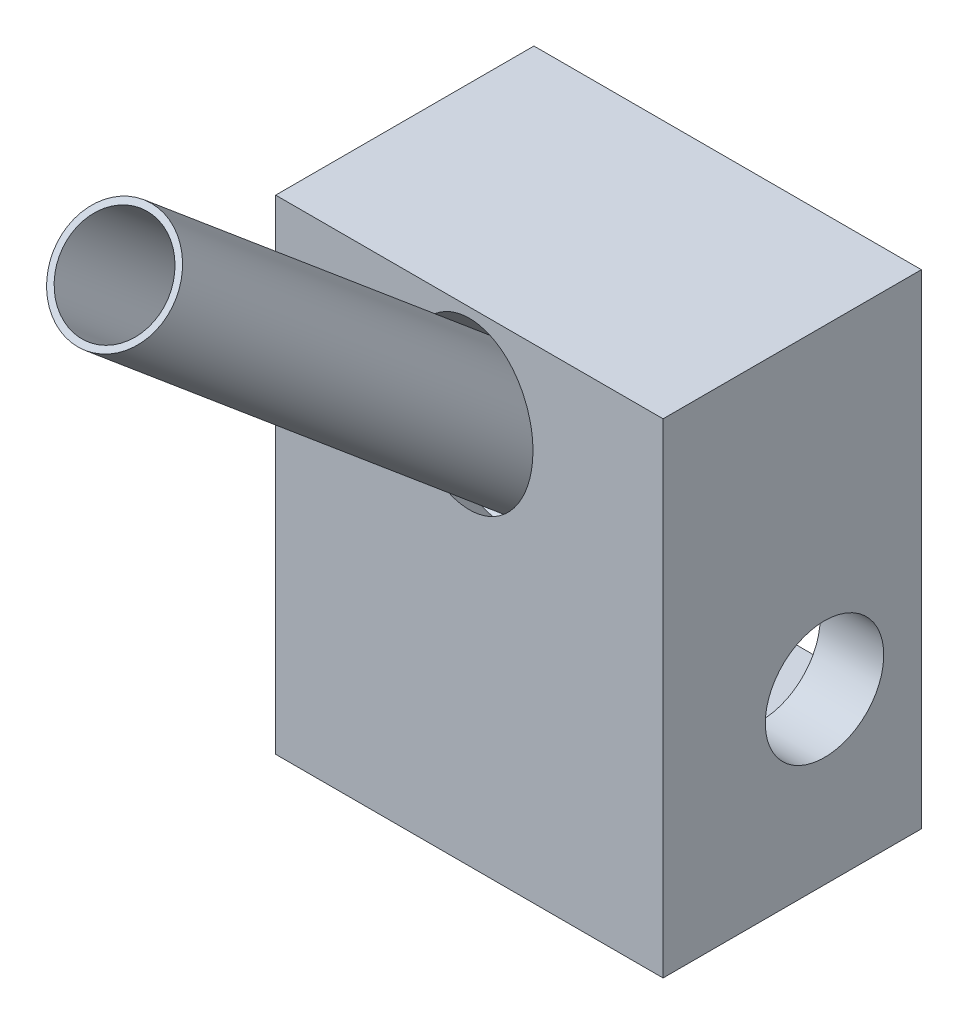
from build123d import *

# Parameters (mm, degrees)
BOSS_EXTRUDE1_START                            = 7.5
SKETCH1_W                                      = 30.48
SKETCH1_H                                      = 38.1
BOSS_EXTRUDE1_DEPTH                            = 20.32
SKETCH2_W                                      = 20.4
SKETCH2_H                                      = 22.86
CUT_EXTRUDE1_DEPTH                             = 17.78
SKETCH5_R                                      = 5
CUT_EXTRUDE2_DEPTH                             = 23
BOSS_EXTRUDE2_DEPTH                            = 21.59
BOSS_EXTRUDE2_DEPTH_BACK                       = 31.75
SKETCH10_R                                     = 4.5
SKETCH11_R                                     = 4
CUT_EXTRUDE6_DEPTH                             = 7540.718926849
CSK_FOR_M3_FLAT_HEAD_MACHINE_SCREW1_AT_2_COUNT = 2
CSK_FOR_M3_FLAT_HEAD_MACHINE_SCREW1_AT_2_PITCH = 36.262943744
CSK_FOR_M3_FLAT_HEAD_MACHINE_SCREW1_AT_3_COUNT = 2
CSK_FOR_M3_FLAT_HEAD_MACHINE_SCREW1_AT_3_PITCH = 30.250374024
SKETCH17_R                                     = 4.659600795
CUT_EXTRUDE7_DEPTH                             = 5742.70602656


with BuildPart() as part:
    # Sketch1 → Boss-Extrude1 (new body)
    with BuildSketch(Plane.XY.offset(BOSS_EXTRUDE1_START)):
        with Locations((6081.534193548, -5722.275806452)):
            Rectangle(SKETCH1_W, SKETCH1_H)
    extrude(amount=BOSS_EXTRUDE1_DEPTH)

    # Sketch2 → Cut-Extrude1 (cut)
    with BuildSketch(Plane(origin=(0, 0, 7.5), x_dir=(-1, 0, 0), z_dir=(0, 0, -1))):
        with Locations((-6081.574193548, -5722.275806452)):
            Rectangle(SKETCH2_W, SKETCH2_H)
    extrude(amount=-CUT_EXTRUDE1_DEPTH, mode=Mode.SUBTRACT)

    # Sketch5 → Cut-Extrude2 (cut)
    with BuildSketch(Plane(origin=(0, -2342.736843325, -2791.965049535), x_dir=(-1, 0, 0), z_dir=(0, -0.6427876096865405, -0.766044443118977))):
        with Locations(Location((-6081.534193548, -4392.394788186, 0), (0, 0, 163.93758294))):
            Circle(SKETCH5_R)
    extrude(amount=CUT_EXTRUDE2_DEPTH, mode=Mode.SUBTRACT)

    # Sketch14 → CSK for M3 Flat Head Machine Screw1 (revolve, cut)
    with BuildSketch(Plane(origin=(6091.777562501, -5707.150620301, 7.5), x_dir=(0, 1, 0), z_dir=(1, 0, 0))):
        Polygon((0, 0), (0, 10), (1.7, 8.978536948), (1.7, 1.45), (3.15, 0), align=None)
    csk_for_m3_flat_head_machine_screw1 = revolve(axis=Axis((6091.777562501, -5707.150620301, 1.15), (0, 0, 1)), mode=Mode.SUBTRACT)

    # CSK for M3 Flat Head Machine Screw1 at 2: CSK for M3 Flat Head Machine Screw1 ×2
    with Locations(*[Vector(-0.5522702954349178, -0.8336651130881205, 0) * (i * CSK_FOR_M3_FLAT_HEAD_MACHINE_SCREW1_AT_2_PITCH) for i in range(1, CSK_FOR_M3_FLAT_HEAD_MACHINE_SCREW1_AT_2_COUNT)]):
        add(csk_for_m3_flat_head_machine_screw1, mode=Mode.SUBTRACT)

    # CSK for M3 Flat Head Machine Screw1 at 3: CSK for M3 Flat Head Machine Screw1 ×2
    with Locations(*[Vector(-0.00011136895503228586, -0.999999993798478, 0) * (i * CSK_FOR_M3_FLAT_HEAD_MACHINE_SCREW1_AT_3_PITCH) for i in range(1, CSK_FOR_M3_FLAT_HEAD_MACHINE_SCREW1_AT_3_COUNT)]):
        add(csk_for_m3_flat_head_machine_screw1, mode=Mode.SUBTRACT)


with BuildPart() as body_2:
    # Sketch10 → Boss-Extrude2 (new, two sides: drawn at the far end of the back side and taken through both)
    with BuildSketch(Plane(origin=(0, -2342.736843325, -2791.965049535), x_dir=(-1, 0, 0), z_dir=(0, -0.6427876096865405, -0.766044443118977)).offset(-BOSS_EXTRUDE2_DEPTH_BACK)):
        with Locations(Location((-6081.534193548, -4392.394788186, 0), (0, 0, 90))):
            Circle(SKETCH10_R)
    extrude(amount=BOSS_EXTRUDE2_DEPTH + BOSS_EXTRUDE2_DEPTH_BACK)

    # Sketch11 → Cut-Extrude6 (cut, through all)
    with BuildSketch(Plane(origin=(0, -2356.614627818, -2808.503949062), x_dir=(1, 0, 0), z_dir=(0, -0.6427876096865406, -0.766044443118977))):
        with Locations(Location((6081.534193548, 4392.394788186, 0), (0, 0, 270))):
            Circle(SKETCH11_R)
    extrude(amount=-CUT_EXTRUDE6_DEPTH, mode=Mode.SUBTRACT)


with BuildPart() as cut_extrude7_tool:
    # Sketch17 → Cut-Extrude7 (new, through all)
    with BuildSketch(Plane(origin=(6096.774193549, 0, 0), x_dir=(0, 0, -1), z_dir=(1, 0, 0))):
        with Locations(Location((-15.12, -5727.992735052, 0), (0, 0, 90))):
            Circle(SKETCH17_R)
    extrude(amount=-CUT_EXTRUDE7_DEPTH)


with BuildPart() as part_1:
    add(part.part)

    # Cut-Extrude7: cut by cut_extrude7_tool
    add(cut_extrude7_tool.part, mode=Mode.SUBTRACT)


with BuildPart() as body_2_1:
    add(body_2.part)

    # Cut-Extrude7: cut by cut_extrude7_tool
    add(cut_extrude7_tool.part, mode=Mode.SUBTRACT)


solid = Compound([part_1.part, body_2_1.part])
